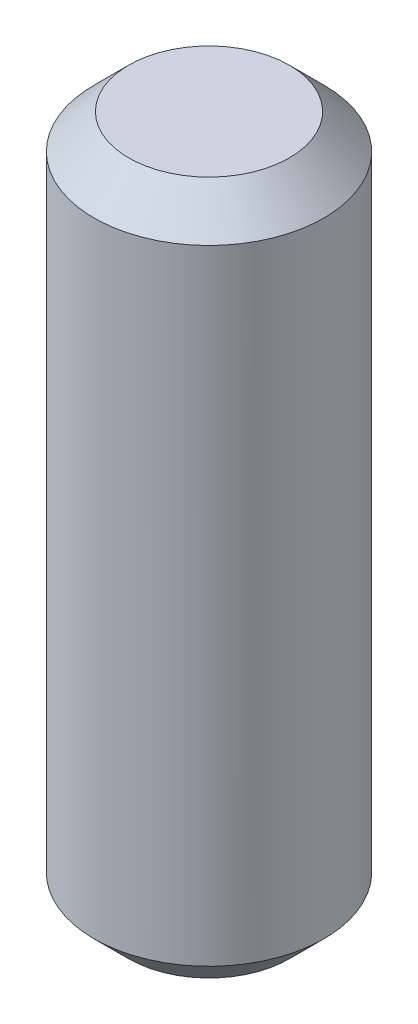
from build123d import *

# Parameters (mm, degrees)
SKETCH2_R           = 4.975
BOSS_EXTRUDE1_DEPTH = 30
CHAMFER1_SIZE       = 1.5


with BuildPart() as part:
    # Sketch2 → Boss-Extrude1 (new body)
    with BuildSketch(Plane(origin=(0, 0, 0), x_dir=(1, 0, 0), z_dir=(0, 1, 0))):
        with Locations(Location((0, 0, 0), (0, 0, 270))):
            Circle(SKETCH2_R)
    extrude(amount=BOSS_EXTRUDE1_DEPTH)

    # Chamfer1
    chamfer1_edges = [part.edges().sort_by_distance(p)[0] for p in [
        (0, 0, -4.975),
        (0, 30, -4.975),
    ]]
    chamfer(chamfer1_edges, length=CHAMFER1_SIZE)


solid = part.part
